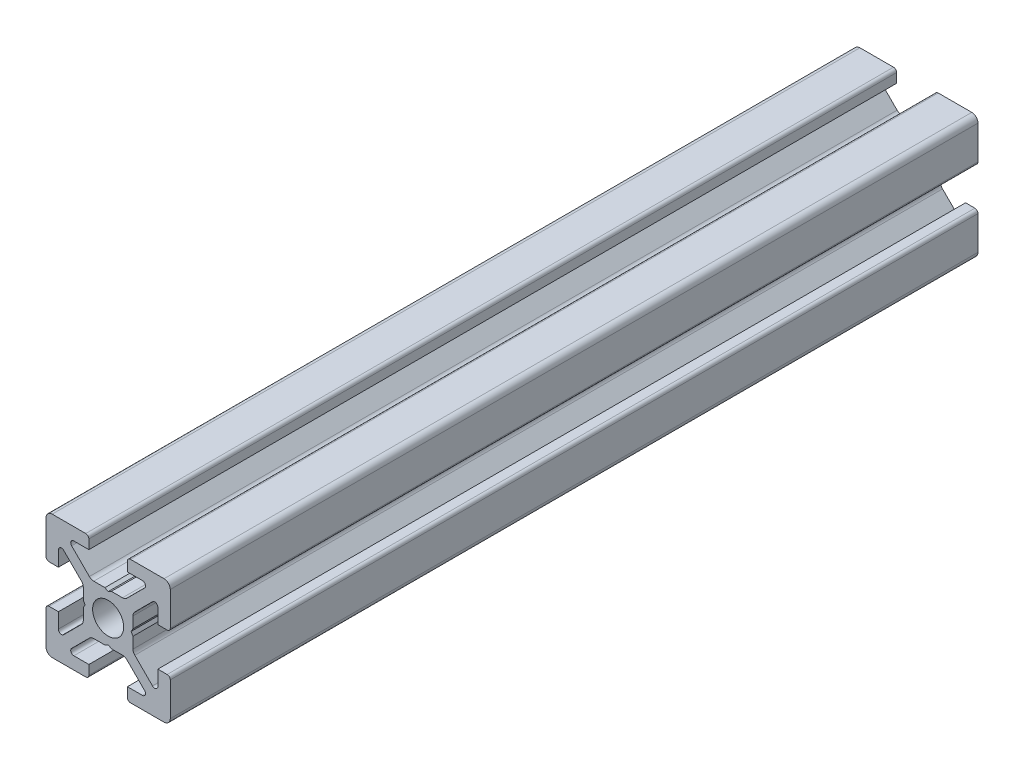
from build123d import *

# Parameters (mm, degrees)
SKETCH_1_R      = 2.5
EXTRUDE_1_DEPTH = 130


with BuildPart() as part:
    # 草图1 → 凸台-拉伸1 (new body)
    with BuildSketch(Plane.XY):
        with BuildLine():
            Line((16.486773435, 27.123343944), (19.340326826, 24.269790554))
            ThreePointArc((19.340326826, 24.269790554), (19.885221932, 24.161404178), (20.193880216, 24.623343944))
            Line((20.193880216, 24.623343944), (20.193880216, 27.043444957))
            Line((20.193880216, 27.043444957), (21.693880216, 27.043444957))
            ThreePointArc((21.693880216, 27.043444957), (22.047433607, 26.896998348), (22.193880216, 26.543444957))
            Line((22.193880216, 26.543444957), (22.193880216, 21.143444957))
            ThreePointArc((22.193880216, 21.143444957), (21.900986997, 20.436338176), (21.193880216, 20.143444957))
            Line((21.193880216, 20.143444957), (15.793880216, 20.143444957))
            ThreePointArc((15.793880216, 20.143444957), (15.440326826, 20.289891566), (15.293880216, 20.643444957))
            Line((15.293880216, 20.643444957), (15.293880216, 22.143444957))
            Line((15.293880216, 22.143444957), (17.713981229, 22.143444957))
            ThreePointArc((17.713981229, 22.143444957), (18.175920995, 22.452103241), (18.06753462, 22.996998348))
            Line((18.06753462, 22.996998348), (15.213981229, 25.850551738))
            ThreePointArc((15.213981229, 25.850551738), (14.88955788, 26.06732449), (14.506874448, 26.143444957))
            Line((14.506874448, 26.143444957), (12.713495459, 26.143444957))
            Line((12.713495459, 26.143444957), (12.193880216, 26.443444957))
            Line((12.193880216, 26.443444957), (11.674264974, 26.143444957))
            Line((11.674264974, 26.143444957), (9.880885985, 26.143444957))
            ThreePointArc((9.880885985, 26.143444957), (9.498202552, 26.06732449), (9.173779204, 25.850551738))
            Line((9.173779204, 25.850551738), (6.320225813, 22.996998348))
            ThreePointArc((6.320225813, 22.996998348), (6.211839437, 22.452103241), (6.673779204, 22.143444957))
            Line((6.673779204, 22.143444957), (9.093880216, 22.143444957))
            Line((9.093880216, 22.143444957), (9.093880216, 20.643444957))
            ThreePointArc((9.093880216, 20.643444957), (8.947433607, 20.289891566), (8.593880216, 20.143444957))
            Line((8.593880216, 20.143444957), (3.193880216, 20.143444957))
            ThreePointArc((3.193880216, 20.143444957), (2.486773435, 20.436338176), (2.193880216, 21.143444957))
            Line((2.193880216, 21.143444957), (2.193880216, 26.543444957))
            ThreePointArc((2.193880216, 26.543444957), (2.340326826, 26.896998348), (2.693880216, 27.043444957))
            Line((2.693880216, 27.043444957), (4.193880216, 27.043444957))
            Line((4.193880216, 27.043444957), (4.193880216, 24.623343944))
            ThreePointArc((4.193880216, 24.623343944), (4.5025385, 24.161404178), (5.047433607, 24.269790554))
            Line((5.047433607, 24.269790554), (7.900986997, 27.123343944))
            ThreePointArc((7.900986997, 27.123343944), (8.117759749, 27.447767293), (8.193880216, 27.830450726))
            Line((8.193880216, 27.830450726), (8.193880216, 29.623829715))
            Line((8.193880216, 29.623829715), (8.493880216, 30.143444957))
            Line((8.493880216, 30.143444957), (8.193880216, 30.663060199))
            Line((8.193880216, 30.663060199), (8.193880216, 32.456439189))
            ThreePointArc((8.193880216, 32.456439189), (8.117759749, 32.839122621), (7.900986997, 33.16354597))
            Line((7.900986997, 33.16354597), (5.047433607, 36.01709936))
            ThreePointArc((5.047433607, 36.01709936), (4.5025385, 36.125485736), (4.193880216, 35.66354597))
            Line((4.193880216, 35.66354597), (4.193880216, 33.243444957))
            Line((4.193880216, 33.243444957), (2.693880216, 33.243444957))
            ThreePointArc((2.693880216, 33.243444957), (2.340326826, 33.389891566), (2.193880216, 33.743444957))
            Line((2.193880216, 33.743444957), (2.193880216, 39.143444957))
            ThreePointArc((2.193880216, 39.143444957), (2.486773435, 39.850551738), (3.193880216, 40.143444957))
            Line((3.193880216, 40.143444957), (8.593880216, 40.143444957))
            ThreePointArc((8.593880216, 40.143444957), (8.947433607, 39.996998348), (9.093880216, 39.643444957))
            Line((9.093880216, 39.643444957), (9.093880216, 38.143444957))
            Line((9.093880216, 38.143444957), (6.673779204, 38.143444957))
            ThreePointArc((6.673779204, 38.143444957), (6.211839437, 37.834786673), (6.320225813, 37.289891566))
            Line((6.320225813, 37.289891566), (9.173779204, 34.436338176))
            ThreePointArc((9.173779204, 34.436338176), (9.498202552, 34.219565425), (9.880885985, 34.143444957))
            Line((9.880885985, 34.143444957), (11.674264974, 34.143444957))
            Line((11.674264974, 34.143444957), (12.193880216, 33.843444957))
            Line((12.193880216, 33.843444957), (12.713495459, 34.143444957))
            Line((12.713495459, 34.143444957), (14.506874448, 34.143444957))
            ThreePointArc((14.506874448, 34.143444957), (14.88955788, 34.219565425), (15.213981229, 34.436338176))
            Line((15.213981229, 34.436338176), (18.06753462, 37.289891566))
            ThreePointArc((18.06753462, 37.289891566), (18.175920995, 37.834786673), (17.713981229, 38.143444957))
            Line((17.713981229, 38.143444957), (15.293880216, 38.143444957))
            Line((15.293880216, 38.143444957), (15.293880216, 39.643444957))
            ThreePointArc((15.293880216, 39.643444957), (15.440326826, 39.996998348), (15.793880216, 40.143444957))
            Line((15.793880216, 40.143444957), (21.193880216, 40.143444957))
            ThreePointArc((21.193880216, 40.143444957), (21.900986997, 39.850551738), (22.193880216, 39.143444957))
            Line((22.193880216, 39.143444957), (22.193880216, 33.743444957))
            ThreePointArc((22.193880216, 33.743444957), (22.047433607, 33.389891566), (21.693880216, 33.243444957))
            Line((21.693880216, 33.243444957), (20.193880216, 33.243444957))
            Line((20.193880216, 33.243444957), (20.193880216, 35.66354597))
            ThreePointArc((20.193880216, 35.66354597), (19.885221932, 36.125485736), (19.340326826, 36.01709936))
            Line((19.340326826, 36.01709936), (16.486773435, 33.16354597))
            ThreePointArc((16.486773435, 33.16354597), (16.270000684, 32.839122621), (16.193880216, 32.456439189))
            Line((16.193880216, 32.456439189), (16.193880216, 30.663060199))
            Line((16.193880216, 30.663060199), (15.893880216, 30.143444957))
            Line((15.893880216, 30.143444957), (16.193880216, 29.623829715))
            Line((16.193880216, 29.623829715), (16.193880216, 27.830450726))
            ThreePointArc((16.193880216, 27.830450726), (16.270000684, 27.447767293), (16.486773435, 27.123343944))
        make_face()
        with Locations((12.193880216, 30.143444957)):
            Circle(SKETCH_1_R, mode=Mode.SUBTRACT)
    extrude(amount=EXTRUDE_1_DEPTH)


solid = part.part
